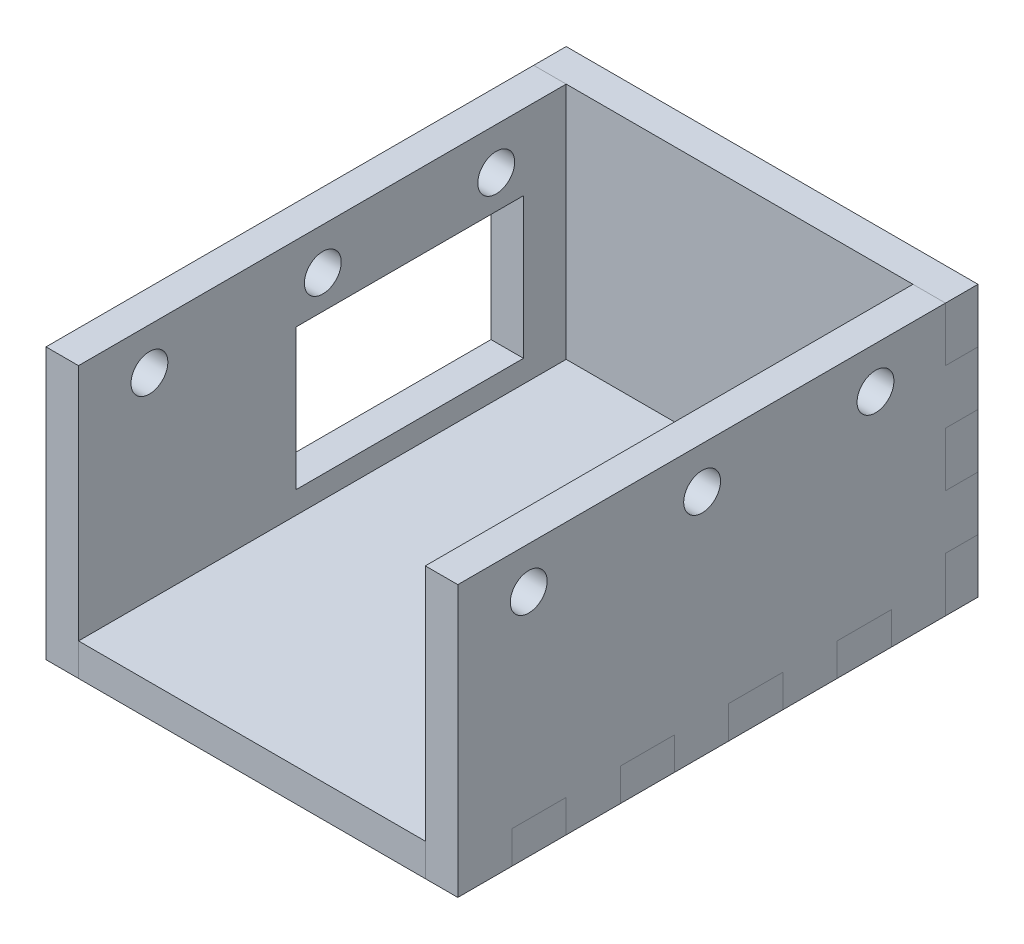
from build123d import *

# Parameters (mm, degrees)
BOSS_EXTRUDE1_DEPTH = 3
BOSS_EXTRUDE2_DEPTH = 3
BOSS_EXTRUDE3_DEPTH = 3
SKETCH6_R           = 1.7
CUT_EXTRUDE1_DEPTH  = 44
SKETCH8_W           = 21
SKETCH8_H           = 13
CUT_EXTRUDE2_DEPTH  = 5


with BuildPart() as part:
    # Sketch1 → Boss-Extrude1 (new body)
    with BuildSketch(Plane(origin=(0, 0, 0), x_dir=(1, 0, 0), z_dir=(0, 1, 0))):
        Polygon((2, 0), (0, 0), (0, -5), (-3, -5), (-3, -10), (0, -10), (0, -15), (-3, -15), (-3, -20), (0, -20), (0, -25), (-3, -25), (-3, -30), (0, -30), (0, -35), (-3, -35), (-3, -40), (0, -40), (0, -45), (32, -45), (32, -40), (35, -40), (35, -35), (32, -35), (32, -30), (35, -30), (35, -25), (32, -25), (32, -20), (35, -20), (35, -15), (32, -15), (32, -10), (35, -10), (35, -5), (32, -5), (32, 0), (30, 0), (30, 3), (25, 3), (25, 0), (20, 0), (20, 3), (15, 3), (15, 0), (10, 0), (10, 3), (5, 3), (5, 0), align=None)
    extrude(amount=BOSS_EXTRUDE1_DEPTH)


with BuildPart() as body_2:
    # Sketch4 → Boss-Extrude2 (new body)
    with BuildSketch(Plane(origin=(32, 0, 0), x_dir=(0, 0, -1), z_dir=(1, 0, 0))):
        Polygon((-5, 3), (-5, 0), (0, 0), (0, 3), (0, 5), (3, 5), (3, 10), (0, 10), (0, 15), (3, 15), (3, 20), (0, 20), (0, 25), (-45, 25), (-45, 3), (-45, 0), (-40, 0), (-40, 3), (-35, 3), (-35, 0), (-30, 0), (-30, 3), (-25, 3), (-25, 0), (-20, 0), (-20, 3), (-15, 3), (-15, 0), (-10, 0), (-10, 3), align=None)
    extrude(amount=BOSS_EXTRUDE2_DEPTH)


with BuildPart() as body_3:
    # Mirror1: mirrored copy
    add(body_2.part.mirror(Plane.ZY.offset(-16)))


with BuildPart() as body_4:
    # Sketch5 → Boss-Extrude3 (new body)
    with BuildSketch(Plane(origin=(0, 0, 0), x_dir=(-1, 0, 0), z_dir=(0, 0, -1))):
        Polygon((-35, 25), (3, 25), (3, 20), (0, 20), (0, 15), (3, 15), (3, 10), (0, 10), (0, 5), (3, 5), (3, 0), (0, 0), (-5, 0), (-5, 3), (-10, 3), (-10, 0), (-15, 0), (-15, 3), (-20, 3), (-20, 0), (-25, 0), (-25, 3), (-30, 3), (-30, 0), (-32, 0), (-35, 0), (-35, 5), (-32, 5), (-32, 10), (-35, 10), (-35, 15), (-32, 15), (-32, 20), (-35, 20), align=None)
    extrude(amount=BOSS_EXTRUDE3_DEPTH)


with BuildPart() as cut_extrude1_tool:
    # Sketch6 → Cut-Extrude1 (new body)
    with BuildSketch(Plane.ZY.offset(3)):
        with Locations((6.457218302, 21.156015904)):
            Circle(SKETCH6_R)
        with Locations((22.457218302, 21.156015904)):
            Circle(SKETCH6_R)
        with Locations((38.457218302, 21.156015904)):
            Circle(SKETCH6_R)
    extrude(amount=-CUT_EXTRUDE1_DEPTH)


with BuildPart() as body_2_1:
    add(body_2.part)

    # Cut-Extrude1: cut by cut_extrude1_tool
    add(cut_extrude1_tool.part, mode=Mode.SUBTRACT)


with BuildPart() as body_3_1:
    add(body_3.part)

    # Cut-Extrude1: cut by cut_extrude1_tool
    add(cut_extrude1_tool.part, mode=Mode.SUBTRACT)

    # Sketch8 → Cut-Extrude2 (cut)
    with BuildSketch(Plane.ZY.offset(3)):
        with Locations((14.439060658, 11.55329355)):
            Rectangle(SKETCH8_W, SKETCH8_H)
    extrude(amount=-CUT_EXTRUDE2_DEPTH, mode=Mode.SUBTRACT)


solid = Compound([part.part, body_4.part, body_2_1.part, body_3_1.part])
